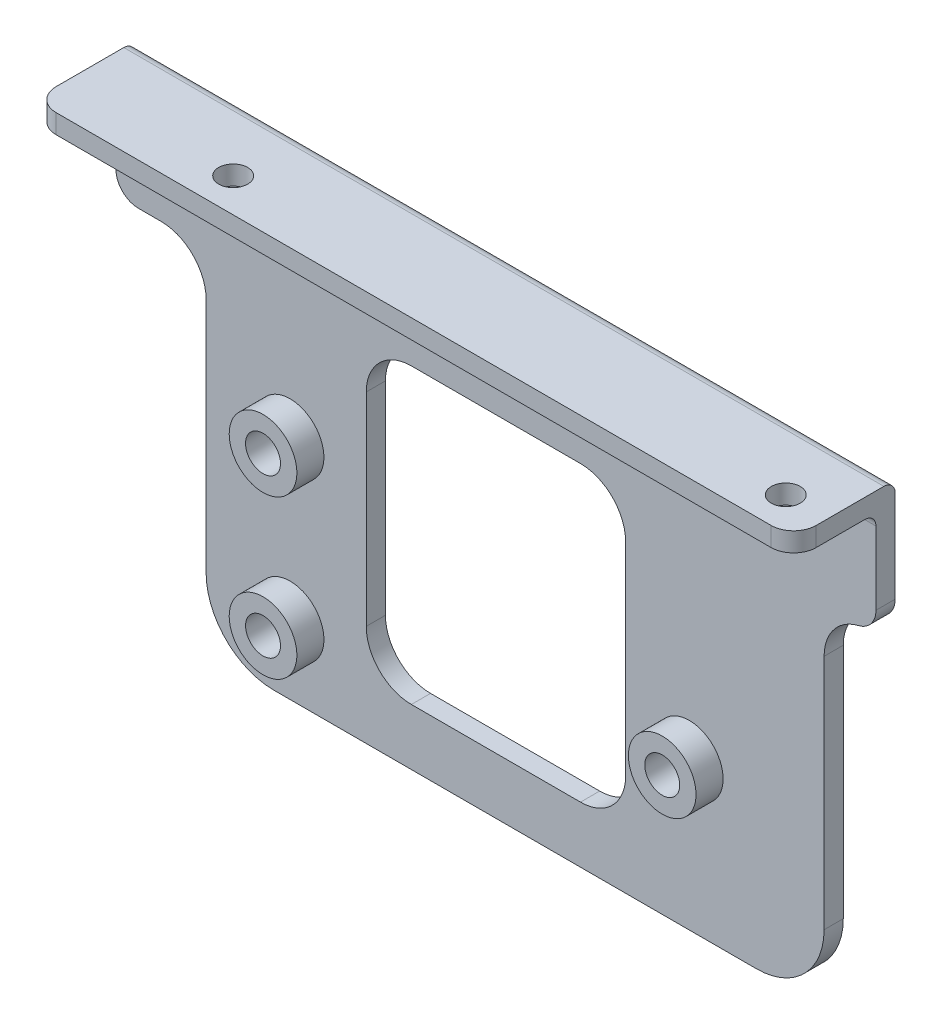
from build123d import *

# Parameters (mm, degrees)
SKETCH1_W             = 85.598
SKETCH1_H             = 53.34
BOSS_EXTRUDE1_DEPTH   = 2.159
SKETCH2_W             = 85.598
SKETCH2_H             = 2.159
BOSS_EXTRUDE2_DEPTH   = 9.271
FILLET1_R             = 1.27
FILLET2_R             = 1.27
FILLET3_R             = 2.54
SKETCH3_W             = 29.21
SKETCH3_H             = 33.02
CUT_EXTRUDE1_DEPTH    = 52.273723699
FILLET5_R             = 5.08
F_4_CLEARANCE_HOLE1_D = 3.2639
SKETCH18_R            = 3.81
BOSS_EXTRUDE6_DEPTH   = 3.048
SKETCH19_R            = 1.9685
CUT_EXTRUDE7_DEPTH    = 3.429
SKETCH20_R            = 0.9525
CUT_EXTRUDE8_DEPTH    = 52.343981195
CUT_EXTRUDE9_DEPTH    = 52.273723699
FILLET6_R             = 2.54
FILLET7_R             = 7.62
CUT_EXTRUDE10_DEPTH   = 52.273723699
FILLET8_R             = 2.54
FILLET9_R             = 7.62


with BuildPart() as part:
    # Sketch1 → Boss-Extrude1 (new body)
    with BuildSketch(Plane.XY):
        Rectangle(SKETCH1_W, SKETCH1_H)
    extrude(amount=BOSS_EXTRUDE1_DEPTH)

    # Sketch2 → Boss-Extrude2 (add)
    with BuildSketch(Plane.XY.offset(2.159)):
        with Locations((0, 25.5905)):
            Rectangle(SKETCH2_W, SKETCH2_H)
    extrude(amount=BOSS_EXTRUDE2_DEPTH)

    # Fillet1
    fillet1_edges = [part.edges().sort_by_distance(p)[0] for p in [
        (0, 24.511, 2.159),
    ]]
    fillet(fillet1_edges, radius=FILLET1_R)

    # Fillet2
    fillet2_edges = [part.edges().sort_by_distance(p)[0] for p in [
        (0, 26.67, 0),
    ]]
    fillet(fillet2_edges, radius=FILLET2_R)

    # Fillet3
    fillet3_edges = [part.edges().sort_by_distance(p)[0] for p in [
        (42.799, 25.5905, 11.43),
        (-42.799, 25.5905, 11.43),
    ]]
    fillet(fillet3_edges, radius=FILLET3_R)

    # Sketch3 → Cut-Extrude1 (cut, through all)
    with BuildSketch(Plane.XY.offset(2.159)):
        with Locations((0, -3.81)):
            Rectangle(SKETCH3_W, SKETCH3_H)
    extrude(amount=-CUT_EXTRUDE1_DEPTH, mode=Mode.SUBTRACT)

    # Fillet5
    fillet5_edges = [part.edges().sort_by_distance(p)[0] for p in [
        (-14.605, -20.32, 1.0795),
        (-14.605, 12.7, 1.0795),
        (14.605, 12.7, 1.0795),
        (14.605, -20.32, 1.0795),
    ]]
    fillet(fillet5_edges, radius=FILLET5_R)

    # #4 Clearance Hole1 (through all)
    with Locations(Plane(origin=(0, 24.511, 0), x_dir=(-1, 0, 0), z_dir=(0, -1, 0))):
        with Locations((-38.1, -7.62), (24.13, -7.62)):
            Hole(F_4_CLEARANCE_HOLE1_D / 2)

    # Sketch18 → Boss-Extrude6 (add)
    with BuildSketch(Plane.XY.offset(2.159)):
        with Locations(Location((-23.18312986, -1.143, 0), (0, 0, 180))):
            Circle(SKETCH18_R)
        with Locations(Location((-23.18312986, -18.923, 0), (0, 0, 180))):
            Circle(SKETCH18_R)
        with Locations(Location((21.77487014, -10.033, 0), (0, 0, 180))):
            Circle(SKETCH18_R)
    extrude(amount=BOSS_EXTRUDE6_DEPTH)

    # Sketch19 → Cut-Extrude7 (cut)
    with BuildSketch(Plane.XY.offset(5.207)):
        with Locations((-23.18312986, -18.923)):
            Circle(SKETCH19_R)
        with Locations((21.77487014, -10.033)):
            Circle(SKETCH19_R)
        with Locations((-23.18312986, -1.143)):
            Circle(SKETCH19_R)
    extrude(amount=-CUT_EXTRUDE7_DEPTH, mode=Mode.SUBTRACT)

    # Sketch20 → Cut-Extrude8 (cut, through all)
    with BuildSketch(Plane.XY.offset(1.778)):
        with Locations((-23.18312986, -1.143)):
            Circle(SKETCH20_R)
        with Locations((-23.18312986, -18.923)):
            Circle(SKETCH20_R)
        with Locations((21.77487014, -10.033)):
            Circle(SKETCH20_R)
    extrude(amount=-CUT_EXTRUDE8_DEPTH, mode=Mode.SUBTRACT)

    # Sketch21 → Cut-Extrude9 (cut, through all)
    with BuildSketch(Plane.XY.offset(2.159)):
        with BuildLine():
            Line((-42.799, 12.7), (-37.719, 12.7))
            ThreePointArc((-37.719, 12.7), (-34.126897552, 11.212102448), (-32.639, 7.62))
            Line((-32.639, 7.62), (-32.639, -26.67))
            Line((-32.639, -26.67), (-42.799, -26.67))
            Line((-42.799, -26.67), (-42.799, 12.7))
        make_face()
    extrude(amount=-CUT_EXTRUDE9_DEPTH, mode=Mode.SUBTRACT)

    # Fillet6
    fillet6_edges = [part.edges().sort_by_distance(p)[0] for p in [
        (-42.799, 12.7, 1.0795),
    ]]
    fillet(fillet6_edges, radius=FILLET6_R)

    # Fillet7
    fillet7_edges = [part.edges().sort_by_distance(p)[0] for p in [
        (-32.639, -26.67, 1.0795),
    ]]
    fillet(fillet7_edges, radius=FILLET7_R)

    # Sketch22 → Cut-Extrude10 (cut, through all)
    with BuildSketch(Plane.XY.offset(2.159)):
        with BuildLine():
            Line((42.799, 12.7), (42.037, 12.7))
            ThreePointArc((42.037, 12.7), (38.444897552, 11.212102448), (36.957, 7.62))
            Line((36.957, 7.62), (36.957, -26.67))
            Line((36.957, -26.67), (42.799, -26.67))
            Line((42.799, -26.67), (42.799, 12.7))
        make_face()
    extrude(amount=-CUT_EXTRUDE10_DEPTH, mode=Mode.SUBTRACT)

    # Fillet8
    fillet8_edges = [part.edges().sort_by_distance(p)[0] for p in [
        (42.799, 12.7, 1.0795),
    ]]
    fillet(fillet8_edges, radius=FILLET8_R)

    # Fillet9
    fillet9_edges = [part.edges().sort_by_distance(p)[0] for p in [
        (36.957, -26.67, 1.0795),
    ]]
    fillet(fillet9_edges, radius=FILLET9_R)


solid = part.part
